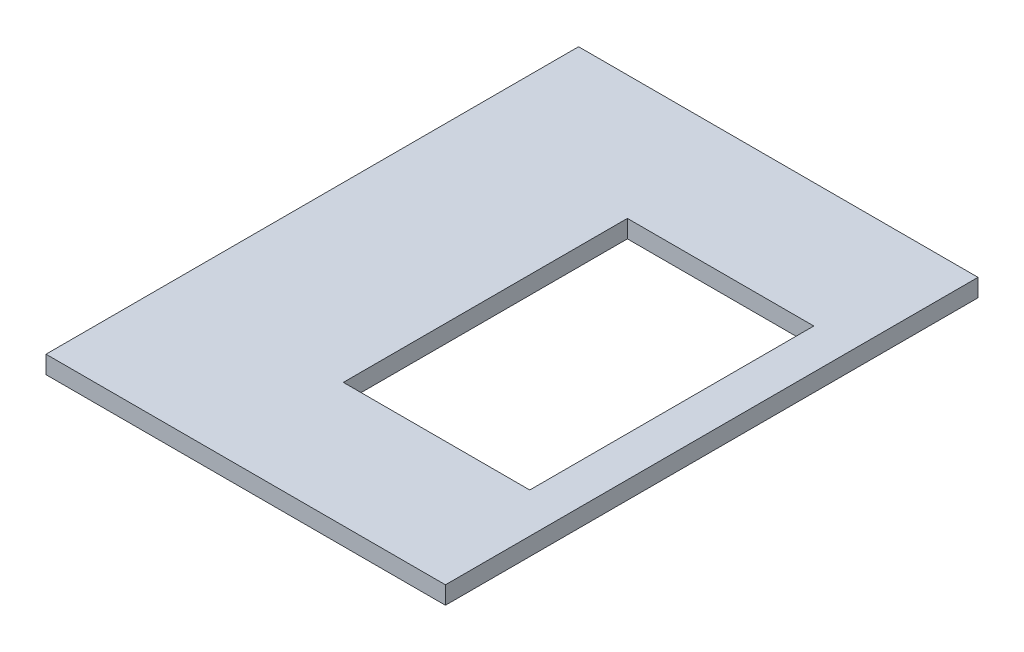
from build123d import *

# Parameters (mm, degrees)
IZIM1_W                     = 45
IZIM1_H                     = 60
Y_KSEKLIK_EKSTR_ZYON1_DEPTH = 2
IZIM2_W                     = 21
IZIM2_H                     = 32
KES_EKSTR_ZYON1_DEPTH       = 2


with BuildPart() as part:
    # Çizim1 → Yükseklik-Ekstrüzyon1 (new body)
    with BuildSketch(Plane(origin=(0, 0, 0), x_dir=(1, 0, 0), z_dir=(0, 1, 0))):
        Rectangle(IZIM1_W, IZIM1_H)
    extrude(amount=Y_KSEKLIK_EKSTR_ZYON1_DEPTH)

    # Çizim2 → Kes-Ekstrüzyon1 (cut)
    with BuildSketch(Plane(origin=(0, 2, 0), x_dir=(1, 0, 0), z_dir=(0, 1, 0))):
        with Locations((7.5, 0)):
            Rectangle(IZIM2_W, IZIM2_H)
    extrude(amount=-KES_EKSTR_ZYON1_DEPTH, mode=Mode.SUBTRACT)


solid = part.part
